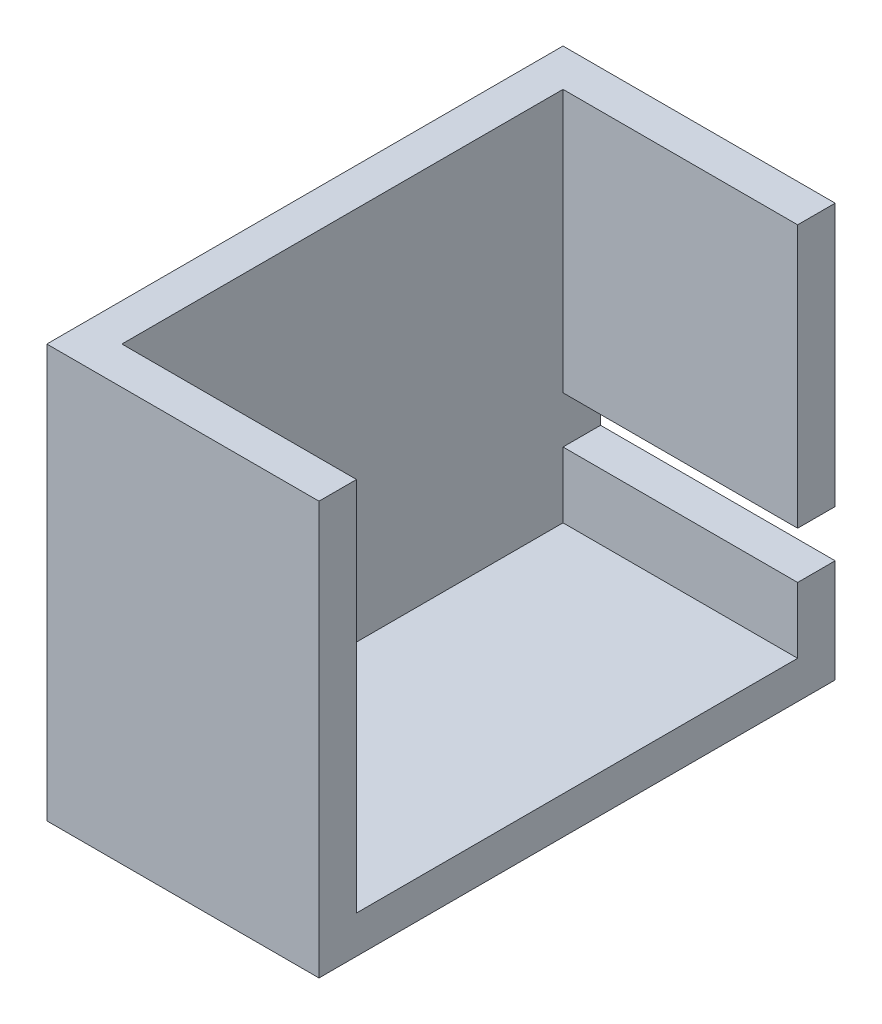
from build123d import *

# Parameters (mm, degrees)
SKETCH_2_W          = 23.5
SKETCH_2_H          = 18
EXTRUDE_1_DEPTH     = 12.5
SHELL_7_T           = 2
SKETCH_4_W          = 2
SKETCH_4_H          = 2.5
CUT_EXTRUDE_3_DEPTH = 35.734708866
SKETCH_6_W          = 12.5
SKETCH_6_H          = 23.5
CUT_EXTRUDE_4_DEPTH = 35.734708866


with BuildPart() as part:
    # Эскиз2 → Бобышка-Вытянуть1 (new body)
    with BuildSketch(Plane(origin=(0, 0, 0), x_dir=(0, 0, -1), z_dir=(1, 0, 0))):
        with Locations((-11.75, 9)):
            Rectangle(SKETCH_2_W, SKETCH_2_H)
    extrude(amount=EXTRUDE_1_DEPTH)

    # Оболочка7
    shell_7_openings = [part.faces().sort_by_distance(p)[0] for p in [
        (12.5, 9, 11.75),
    ]]
    offset(amount=SHELL_7_T, openings=shell_7_openings, kind=Kind.INTERSECTION)

    # Эскиз4 → Вырез-Вытянуть3 (cut, through all)
    with BuildSketch(Plane(origin=(0, 0, 0), x_dir=(0, 0, -1), z_dir=(1, 0, 0))):
        with Locations((1, 4.75)):
            Rectangle(SKETCH_4_W, SKETCH_4_H)
    extrude(amount=CUT_EXTRUDE_3_DEPTH, mode=Mode.SUBTRACT)

    # Эскиз6 → Вырез-Вытянуть4 (cut, through all)
    with BuildSketch(Plane.XZ.offset(-18)):
        with Locations((6.25, 11.75)):
            Rectangle(SKETCH_6_W, SKETCH_6_H)
    extrude(amount=-CUT_EXTRUDE_4_DEPTH, mode=Mode.SUBTRACT)


solid = part.part
